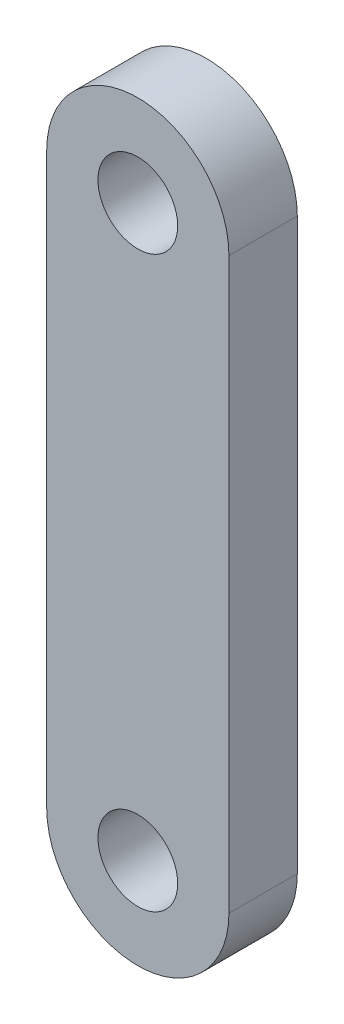
from build123d import *

# Parameters (mm, degrees)
ESBO_O1_R                = 1.75
RESSALTO_EXTRUS_O1_DEPTH = 3


with BuildPart() as part:
    # Esboço1 → Ressalto-extrusão1 (new body)
    with BuildSketch(Plane.XY):
        with BuildLine():
            Line((4, 12.5), (4, -12.5))
            ThreePointArc((4, -12.5), (0, -16.5), (-4, -12.5))
            Line((-4, -12.5), (-4, 12.5))
            ThreePointArc((-4, 12.5), (0, 16.5), (4, 12.5))
        make_face()
        with Locations((0, 12.5)):
            Circle(ESBO_O1_R, mode=Mode.SUBTRACT)
        with Locations((0, -12.5)):
            Circle(ESBO_O1_R, mode=Mode.SUBTRACT)
    extrude(amount=RESSALTO_EXTRUS_O1_DEPTH)


solid = part.part
